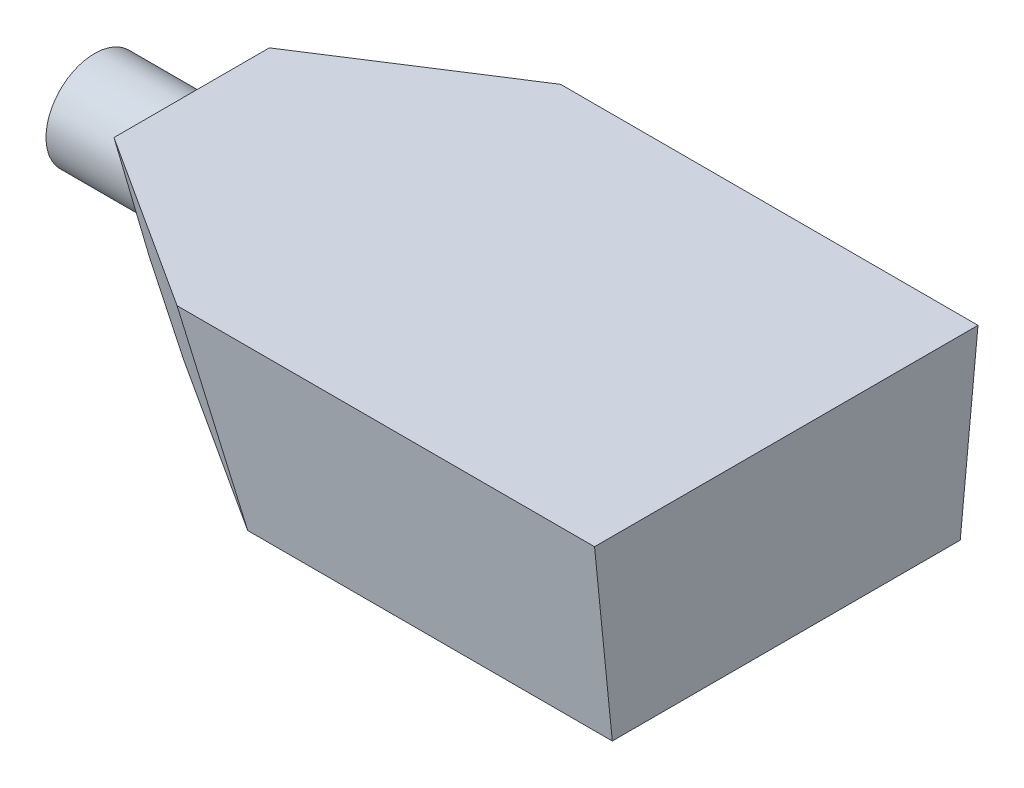
from build123d import *

# Parameters (mm, degrees)
SKETCH1_W           = 86
SKETCH1_H           = 79
BOSS_EXTRUDE1_DEPTH = 36.5
CUT_EXTRUDE4_DEPTH  = 113.8543313
CUT_EXTRUDE6_DEPTH  = 117.39336237
SKETCH23_W          = 52.496433732
SKETCH23_H          = 95.180046085
CUT_EXTRUDE9_DEPTH  = 99.910462918
SKETCH26_W          = 80.038892534
SKETCH26_H          = 43.235962509
CUT_EXTRUDE10_DEPTH = 122.988754281
SKETCH27_R          = 10
BOSS_EXTRUDE2_DEPTH = 20
SKETCH28_R          = 9.1
CUT_EXTRUDE11_DEPTH = 20


with BuildPart() as part:
    # Sketch1 → Boss-Extrude1 (new body)
    with BuildSketch(Plane(origin=(0, 0, 0), x_dir=(1, 0, 0), z_dir=(0, 1, 0))):
        Polygon((-79.5, 16), (-79.5, -16), (-43, -39.5), (-43, 39.5), align=None)
        Rectangle(SKETCH1_W, SKETCH1_H)
    extrude(amount=BOSS_EXTRUDE1_DEPTH)

    # Sketch14 → Cut-Extrude4 (cut, through all)
    with BuildSketch(Plane(origin=(-24.252710924, -11.01949414, 37.669104201), x_dir=(0.8506873519118823, -0.14759139817848807, 0.5045273119275789), z_dir=(-0.5256719788015616, -0.23884502264638724, 0.8164692436705117))):
        Polygon((-9.224645292, 10.062781894), (-22.037813345, 46.122121953), (-64.94429352, 39.524095052), (-109.490464552, 32.673921521), (-56.610292459, -14.345266084), align=None)
    cut_extrude4 = extrude(amount=CUT_EXTRUDE4_DEPTH, mode=Mode.SUBTRACT)

    # Sketch15 → Cut-Extrude6 (cut, through all)
    with BuildSketch(Plane(origin=(0, -3.557773101, 35.48359566), x_dir=(1, 0, 0), z_dir=(0, -0.0997650710839227, 0.9950110203367698))):
        Polygon((43, 3.575611755), (43, 40.25862255), (-43, 40.25862255), (-38.621652742, -4.136841908), align=None)
    cut_extrude6 = extrude(amount=CUT_EXTRUDE6_DEPTH, mode=Mode.SUBTRACT)

    # Mirror7: Cut-Extrude4, Cut-Extrude6 across plane
    add(cut_extrude4.mirror(Plane.XY), mode=Mode.SUBTRACT)
    add(cut_extrude6.mirror(Plane.XY), mode=Mode.SUBTRACT)

    # Sketch23 → Cut-Extrude9 (cut, through all)
    with BuildSketch(Plane(origin=(-18.267826798, -30.352696834, 0), x_dir=(-0.8567921384922006, 0.515661935203639, 0), z_dir=(-0.515661935203639, -0.8567921384922006, 0))):
        with Locations((54.636530777, 2.381508201)):
            Rectangle(SKETCH23_W, SKETCH23_H)
    extrude(amount=CUT_EXTRUDE9_DEPTH, mode=Mode.SUBTRACT)

    # Sketch26 → Cut-Extrude10 (cut, through all)
    with BuildSketch(Plane(origin=(-35.634500138, -23.512575375, 31.888811139), x_dir=(0.4994950200350479, 0.3295798808101732, 0.8011752786533913), z_dir=(-0.6687218639205573, -0.4412401793127581, 0.598429756007053))):
        with Locations((-7.20146585, 56.642835767)):
            Rectangle(SKETCH26_W, SKETCH26_H)
    cut_extrude10 = extrude(amount=CUT_EXTRUDE10_DEPTH, mode=Mode.SUBTRACT)

    # Mirror9: Cut-Extrude10 across plane
    add(cut_extrude10.mirror(Plane.XY), mode=Mode.SUBTRACT)

    # Sketch27 → Boss-Extrude2 (add)
    with BuildSketch(Plane.ZY.offset(79.5)):
        with Locations((0, 23.5)):
            Circle(SKETCH27_R)
    extrude(amount=BOSS_EXTRUDE2_DEPTH)

    # Sketch28 → Cut-Extrude11 (cut)
    with BuildSketch(Plane.ZY.offset(99.5)):
        with Locations((0, 23.5)):
            Circle(SKETCH28_R)
    extrude(amount=-CUT_EXTRUDE11_DEPTH, mode=Mode.SUBTRACT)


solid = part.part
